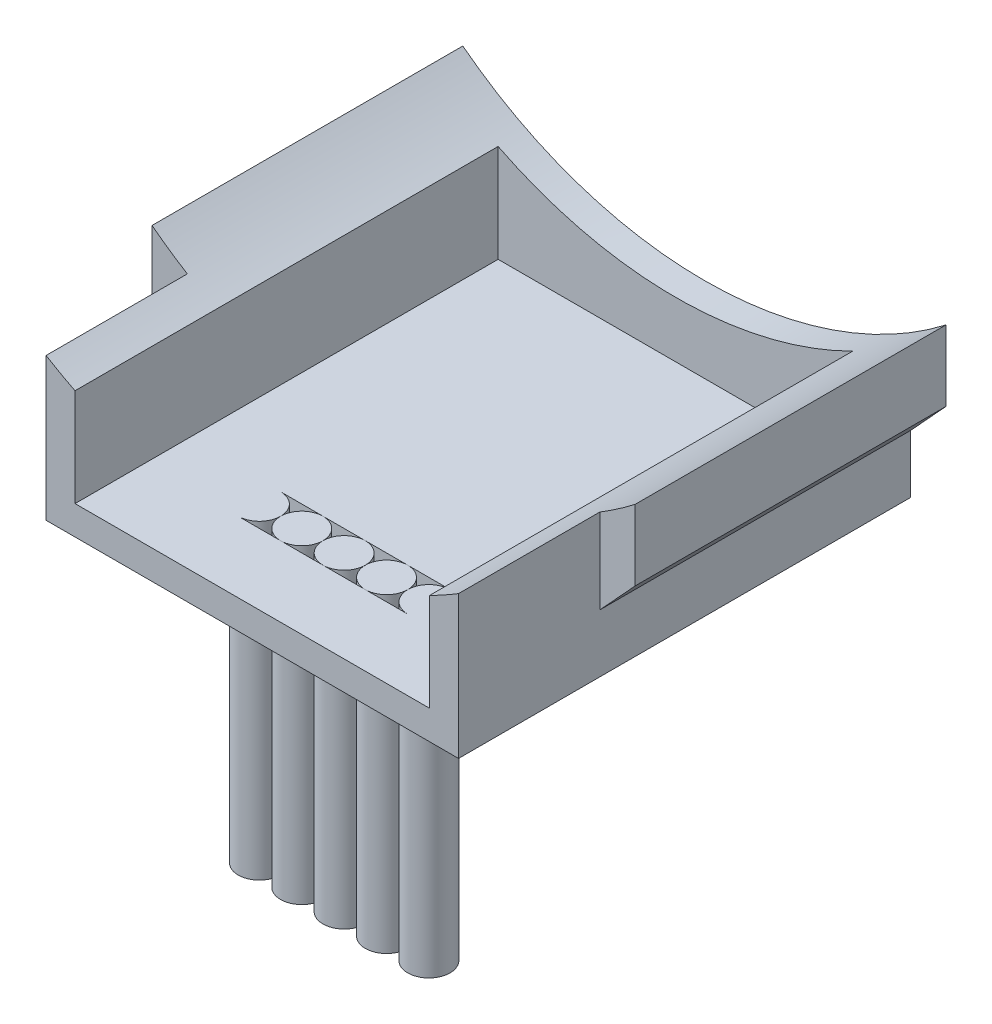
from build123d import *
from build123d.topology import SkipClean

# Parameters (mm, degrees)
BOSS_EXTRU_1_DEPTH      = 16
BOSS_EXTRU_2_REACH      = 20.298
BOSS_EXTRU_2_END_RADIUS = 14
ESQUISSE2_W             = 14.6
ESQUISSE2_H             = 1.025
BOSS_EXTRU_3_START      = -11
BOSS_EXTRU_3_DEPTH      = 11
ENL_V_MAT_EXTRU_1_DEPTH = 11
BOSS_EXTRU_4_START      = -11
ESQUISSE5_R             = 0.75
BOSS_EXTRU_4_DEPTH      = 11


with BuildPart() as part:
    # Esquisse1 → Boss.-Extru.1 (new body)
    with BuildSketch(Plane.XY):
        with BuildLine():
            Line((-7.3, -17), (7.3, -17))
            Line((7.3, -17), (7.3, -11.94612908))
            ThreePointArc((7.3, -11.94612908), (6.793456419, -12.241280565), (6.275, -12.514966041))
            Line((6.275, -12.514966041), (6.275, -15.975))
            Line((6.275, -15.975), (-6.275, -15.975))
            Line((-6.275, -15.975), (-6.275, -12.514966041))
            ThreePointArc((-6.275, -12.514966041), (-6.793456419, -12.241280565), (-7.3, -11.94612908))
            Line((-7.3, -11.94612908), (-7.3, -17))
        make_face()
    extrude(amount=-BOSS_EXTRU_1_DEPTH)

    # Boss.-Extru.2: up to this cylinder (the profile starts outside it)
    with SkipClean():  # the faces are left unmerged after this step: merging them gives an invalid solid
        boss_extru_2_end = Plane(origin=(0, 0, -15.4875), z_dir=(0, 0, 1)) * Cylinder(BOSS_EXTRU_2_END_RADIUS, 69.596, mode=Mode.PRIVATE)
        # Esquisse2 → Boss.-Extru.2 (add, up to the surface)
        with BuildSketch(Plane.XZ.offset(17), mode=Mode.PRIVATE) as boss_extru_2_sk1:
            with Locations((0, -15.4875)):
                Rectangle(ESQUISSE2_W, ESQUISSE2_H)
        boss_extru_2_tool1 = extrude(boss_extru_2_sk1.sketch, amount=-BOSS_EXTRU_2_REACH, mode=Mode.PRIVATE) - boss_extru_2_end
        add(boss_extru_2_tool1.solids().sort_by_distance((0, -17, -15.4875))[0])

    # Esquisse3 → Boss.-Extru.3 (add)
    with SkipClean():  # the faces are left unmerged after this step: merging them gives an invalid solid
        with BuildSketch(Plane(origin=(0, 0, -16), x_dir=(-1, 0, 0), z_dir=(0, 0, -1)).offset(BOSS_EXTRU_3_START)):
            with BuildLine():
                Line((-7.3, -11.94612908), (-7.3, -14.94612908))
                Line((-7.3, -14.94612908), (-8.55, -13.585914486))
                Line((-8.55, -13.585914486), (-8.55, -11.085914486))
                ThreePointArc((-8.55, -11.085914486), (-7.936662856, -11.53296938), (-7.3, -11.94612908))
            make_face()
            with BuildLine():
                Line((8.55, -13.585914486), (8.55, -11.085914486))
                ThreePointArc((8.55, -11.085914486), (7.936662856, -11.53296938), (7.3, -11.94612908))
                Line((7.3, -11.94612908), (7.3, -14.94612908))
                Line((7.3, -14.94612908), (8.55, -13.585914486))
            make_face()
        extrude(amount=BOSS_EXTRU_3_DEPTH)

    # Esquisse4 → Enlèv. mat.-Extru.1 (cut)
    with SkipClean():  # the faces are left unmerged after this step: merging them gives an invalid solid
        with BuildSketch(Plane.XZ.offset(17)):
            with BuildLine():
                Line((-3, -2.5), (3, -2.5))
                ThreePointArc((3, -2.5), (3.75, -3.25), (3, -4))
                Line((3, -4), (-3, -4))
                ThreePointArc((-3, -4), (-3.75, -3.25), (-3, -2.5))
            make_face()
        extrude(amount=-ENL_V_MAT_EXTRU_1_DEPTH, mode=Mode.SUBTRACT)

    # Esquisse5 → Boss.-Extru.4 (add)
    with SkipClean():  # the faces are left unmerged after this step: merging them gives an invalid solid
        with BuildSketch(Plane(origin=(0, -15.975, 0), x_dir=(1, 0, 0), z_dir=(0, 1, 0)).offset(BOSS_EXTRU_4_START)):
            with BuildLine():
                ThreePointArc((2.25, 3.25), (1.5, 4), (0.75, 3.25))
                ThreePointArc((0.75, 3.25), (1.5, 2.5), (2.25, 3.25))
            make_face()
            with Locations(Location((3, 3.25, 0), (0, 0, 270))):
                Circle(ESQUISSE5_R)
            with Locations(Location((-3, 3.25, 0), (0, 0, 270))):
                Circle(ESQUISSE5_R)
            with BuildLine():
                ThreePointArc((-2.25, 3.25), (-1.5, 2.5), (-0.75, 3.25))
                ThreePointArc((-0.75, 3.25), (-1.5, 4), (-2.25, 3.25))
            make_face()
            with BuildLine():
                ThreePointArc((-0.75, 3.25), (0, 2.5), (0.75, 3.25))
                ThreePointArc((0.75, 3.25), (0, 4), (-0.75, 3.25))
            make_face()
        extrude(amount=BOSS_EXTRU_4_DEPTH)


solid = part.part
